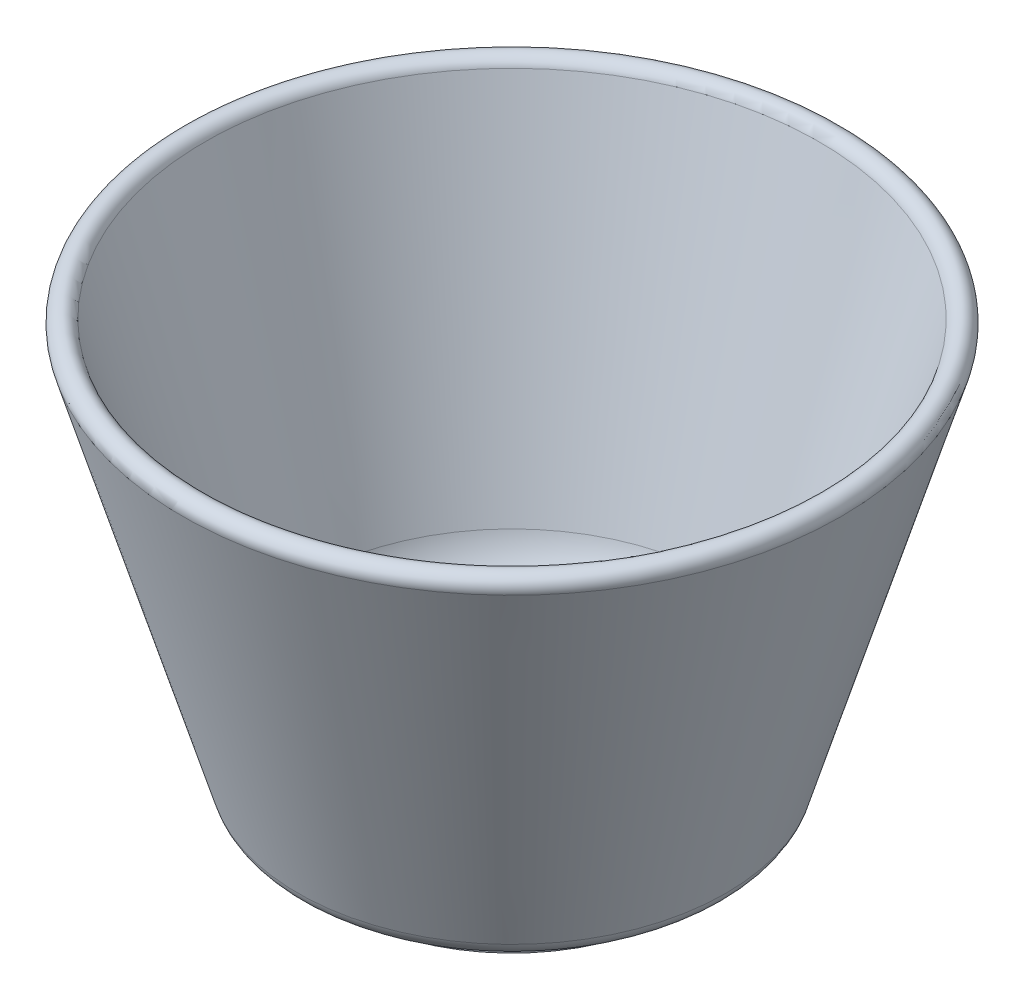
from build123d import *

# Parameters (mm, degrees)
FILLET_1_R = 2


with BuildPart() as part:
    # 草图2 → 旋转1 (revolve)
    with BuildSketch(Plane.XY, mode=Mode.PRIVATE) as revolve_1_sk:
        with BuildLine():
            Line((-40, 50), (-27.137956343, 7.126521144))
            ThreePointArc((-27.137956343, 7.126521144), (-23.528998787, 1.977070717), (-17.559693491, 0))
            Line((-17.559693491, 0), (0, 0))
            Line((0, 0), (0, -3))
            Line((0, -3), (-19, -3))
            Line((-19, -3), (-19, -6))
            Line((-19, -6), (-22, -6))
            Line((-22, -6), (-22, -3))
            Line((-22, -3), (-25, -3))
            ThreePointArc((-25, -3), (-26.790791589, -2.406878785), (-27.873478856, -0.862043657))
            Line((-27.873478856, -0.862043657), (-42.873478856, 49.137956343))
            ThreePointArc((-42.873478856, 49.137956343), (-41.867761256, 51.005717599), (-40, 50))
        make_face()
    revolve(revolve_1_sk.sketch.rotate(Axis((0, -950.324066191, 0), (0, 1, 0)), 180), axis=Axis((0, -950.324066191, 0), (0, 1, 0)))

    # 圆角1
    fillet_1_edges = [part.edges().sort_by_distance(p)[0] for p in [
        (-19, -3, 0),
        (-22, -3, 0),
    ]]
    fillet(fillet_1_edges, radius=FILLET_1_R)


solid = part.part
